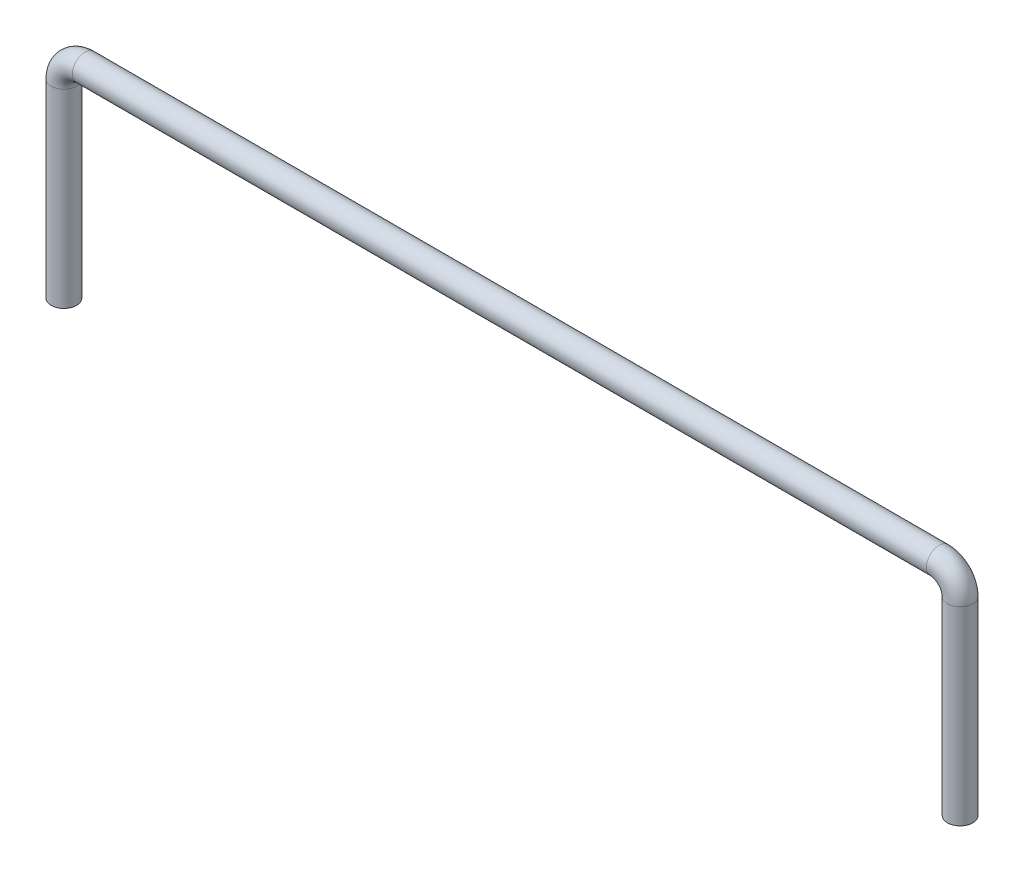
from build123d import *

# Parameters (mm, degrees)
SWEEP1_PROFILE_R = 0.6


with BuildPart() as part:
    # Sweep1: sweep along a path in Sketch1
    with BuildLine(Plane.XY) as sweep1_path:
        Line((0, 0), (0, 9))
        ThreePointArc((0, 9), (0.292893219, 9.707106781), (1, 10))
        Line((1, 10), (41.5, 10))
        ThreePointArc((41.5, 10), (42.207106781, 9.707106781), (42.5, 9))
        Line((42.5, 9), (42.5, 0))
    # Sweep1 profile (on start of the path) → Sweep1 (sweep)
    with BuildSketch(Plane.ZX):
        Circle(SWEEP1_PROFILE_R)
    sweep(path=sweep1_path.line)


solid = part.part
